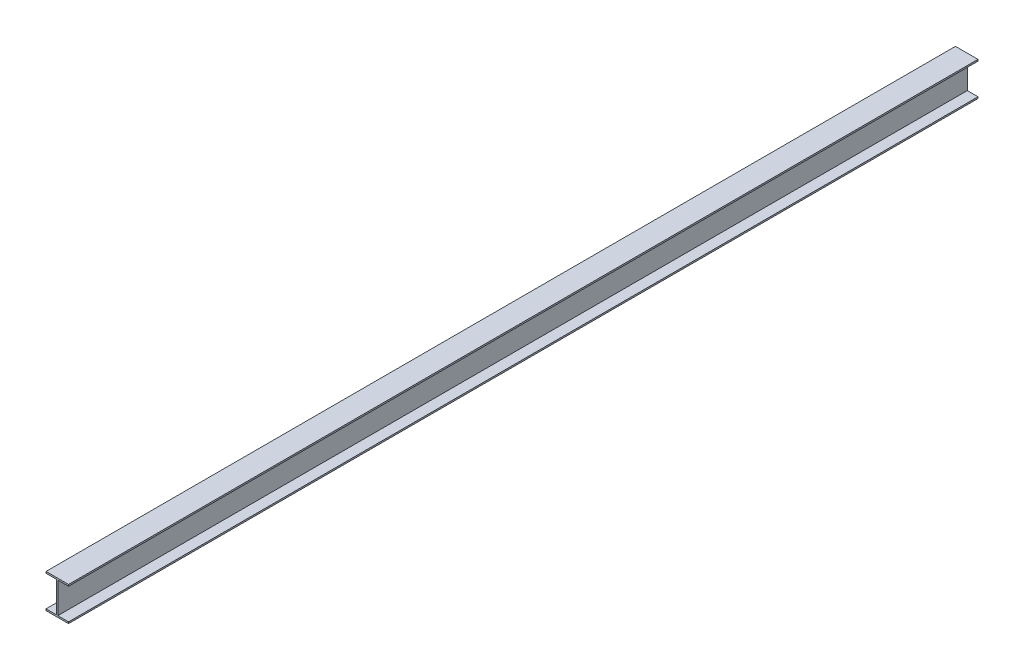
from build123d import *

# Parameters (mm, degrees)
BOSS_EXTRUDE1_DEPTH = 4100


with BuildPart() as part:
    # Sketch1 → Boss-Extrude1 (new body)
    with BuildSketch(Plane.XY):
        Polygon((0, -0.000240533), (101.6, -0.000240533), (101.6, -7.112240533), (53.408035714, -7.112240533), (53.408035714, -146.050240533), (101.6, -146.050240533), (101.6, -153.162240533), (0, -153.162240533), (0, -146.050240533), (47.566035714, -146.050240533), (47.566035714, -7.112240533), (0, -7.112240533), align=None)
    extrude(amount=BOSS_EXTRUDE1_DEPTH)


solid = part.part
